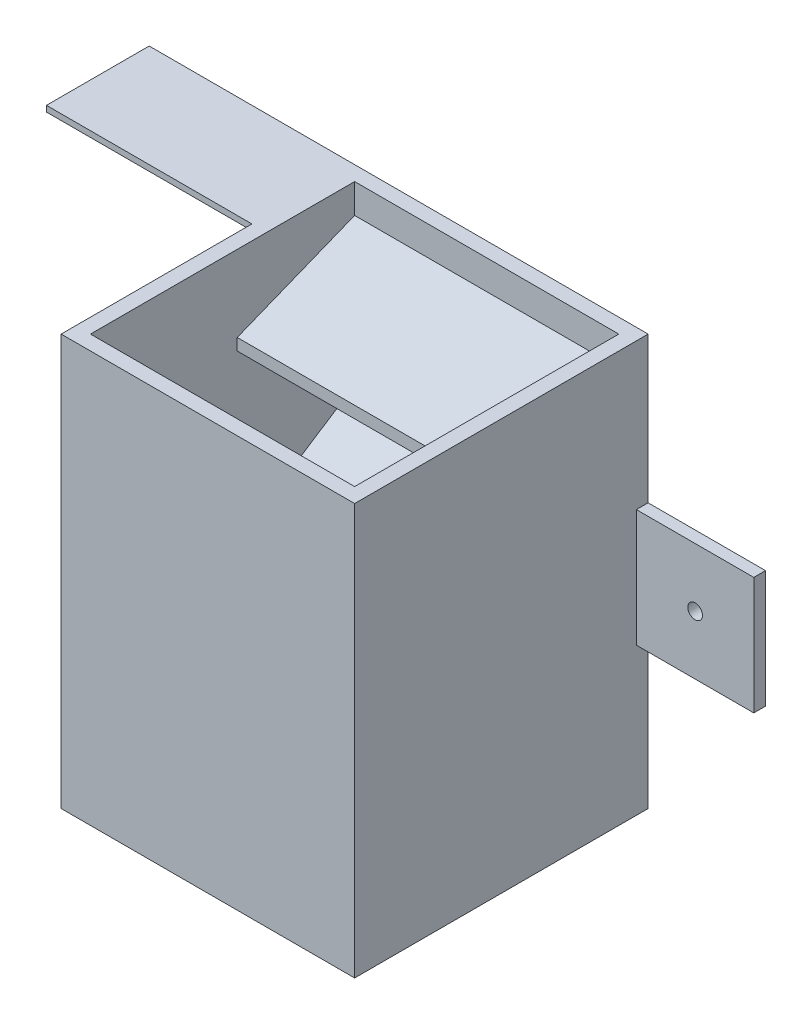
from build123d import *

# Parameters (mm, degrees)
CROQUIS2_W              = 50
CROQUIS2_H              = 50
SALIENTE_EXTRUIR1_DEPTH = 70
CROQUIS3_W              = 45
CROQUIS3_H              = 45
CORTAR_EXTRUIR1_DEPTH   = 130
CROQUIS4_W              = 45
CROQUIS4_H              = 10
SALIENTE_EXTRUIR2_DEPTH = 20
CORTAR_EXTRUIR2_DEPTH   = 45
CROQUIS7_W              = 20
CROQUIS7_H              = 15
SALIENTE_EXTRUIR3_DEPTH = 45
CORTAR_EXTRUIR3_DEPTH   = 45
CROQUIS9_W              = 20
CROQUIS9_H              = 15
SALIENTE_EXTRUIR4_DEPTH = 45
CORTAR_EXTRUIR4_DEPTH   = 45
CROQUIS16_W             = 35
CROQUIS16_H             = 17.5
SALIENTE_EXTRUIR7_DEPTH = 1
CROQUIS17_W             = 20
CROQUIS17_H             = 20
CROQUIS17_R             = 1.25
SALIENTE_EXTRUIR8_DEPTH = 2


with BuildPart() as part:
    # Croquis2 → Saliente-Extruir1 (new body)
    with BuildSketch(Plane(origin=(0, 0, 0), x_dir=(1, 0, 0), z_dir=(0, 1, 0))):
        with Locations((-11.197183099, 3.221830986)):
            Rectangle(CROQUIS2_W, CROQUIS2_H)
    extrude(amount=SALIENTE_EXTRUIR1_DEPTH)

    # Croquis3 → Cortar-Extruir1 (cut)
    with BuildSketch(Plane(origin=(0, 70, 0), x_dir=(1, 0, 0), z_dir=(0, 1, 0))):
        with Locations((-11.197183099, 3.221830986)):
            Rectangle(CROQUIS3_W, CROQUIS3_H)
    extrude(amount=-CORTAR_EXTRUIR1_DEPTH, mode=Mode.SUBTRACT)

    # Croquis4 → Saliente-Extruir2 (add)
    with BuildSketch(Plane.XY.offset(-25.721830986)):
        with Locations((-11.197183099, 60)):
            Rectangle(CROQUIS4_W, CROQUIS4_H)
    extrude(amount=SALIENTE_EXTRUIR2_DEPTH)

    # Croquis5 → Cortar-Extruir2 (cut)
    with BuildSketch(Plane(origin=(-33.697183099, 0, 0), x_dir=(0, 0, -1), z_dir=(1, 0, 0))):
        Polygon((5.721830986, 65), (25.721830986, 65), (5.721830986, 57), align=None)
        Polygon((25.721830986, 55), (25.721830986, 63), (5.721830986, 55), align=None)
    extrude(amount=CORTAR_EXTRUIR2_DEPTH, mode=Mode.SUBTRACT)

    # Croquis7 → Saliente-Extruir3 (add)
    with BuildSketch(Plane(origin=(-33.697183099, 0, 0), x_dir=(0, 0, -1), z_dir=(1, 0, 0))):
        with Locations((-9.278169014, 47.5)):
            Rectangle(CROQUIS7_W, CROQUIS7_H)
    extrude(amount=SALIENTE_EXTRUIR3_DEPTH)

    # Croquis8 → Cortar-Extruir3 (cut)
    with BuildSketch(Plane(origin=(-33.697183099, 0, 0), x_dir=(0, 0, -1), z_dir=(1, 0, 0))):
        Polygon((0.721830986, 55), (0.721830986, 42), (-19.278169014, 55), align=None)
        Polygon((0.721830986, 40), (-19.278169014, 40), (-19.278169014, 53), align=None)
    extrude(amount=CORTAR_EXTRUIR3_DEPTH, mode=Mode.SUBTRACT)

    # Croquis9 → Saliente-Extruir4 (add)
    with BuildSketch(Plane(origin=(-33.697183099, 0, 0), x_dir=(0, 0, -1), z_dir=(1, 0, 0))):
        with Locations((15.721830986, 32.5)):
            Rectangle(CROQUIS9_W, CROQUIS9_H)
    extrude(amount=SALIENTE_EXTRUIR4_DEPTH)

    # Croquis10 → Cortar-Extruir4 (cut)
    with BuildSketch(Plane(origin=(-33.697183099, 0, 0), x_dir=(0, 0, -1), z_dir=(1, 0, 0))):
        Polygon((5.721830986, 40), (5.721830986, 27), (25.721830986, 40), align=None)
        Polygon((5.721830986, 25), (25.721830986, 25), (25.721830986, 38), align=None)
    extrude(amount=CORTAR_EXTRUIR4_DEPTH, mode=Mode.SUBTRACT)

    # Croquis16 → Saliente-Extruir7 (add)
    with BuildSketch(Plane(origin=(0, 70, 0), x_dir=(1, 0, 0), z_dir=(0, 1, 0))):
        with Locations((-53.697183099, 19.471830986)):
            Rectangle(CROQUIS16_W, CROQUIS16_H)
    extrude(amount=-SALIENTE_EXTRUIR7_DEPTH)

    # Croquis17 → Saliente-Extruir8 (add)
    # profile 1 of 2: a face of its own
    with BuildSketch(Plane(origin=(0, 0, -28.221830986), x_dir=(-1, 0, 0), z_dir=(0, 0, -1))):
        with Locations((-23.802816901, 35.103644725)):
            Rectangle(CROQUIS17_W, CROQUIS17_H)
        with Locations((-23.802816901, 35.103644725)):
            Circle(CROQUIS17_R, mode=Mode.SUBTRACT)
    # profile 2 of 2: a face of its own
    with BuildSketch(Plane(origin=(0, 0, -28.221830986), x_dir=(-1, 0, 0), z_dir=(0, 0, -1))):
        with Locations((46.197183099, 35.103644725)):
            Rectangle(CROQUIS17_W, CROQUIS17_H)
        with Locations((46.197183099, 35.103644725)):
            Circle(CROQUIS17_R, mode=Mode.SUBTRACT)
    extrude(amount=-SALIENTE_EXTRUIR8_DEPTH)


solid = part.part
